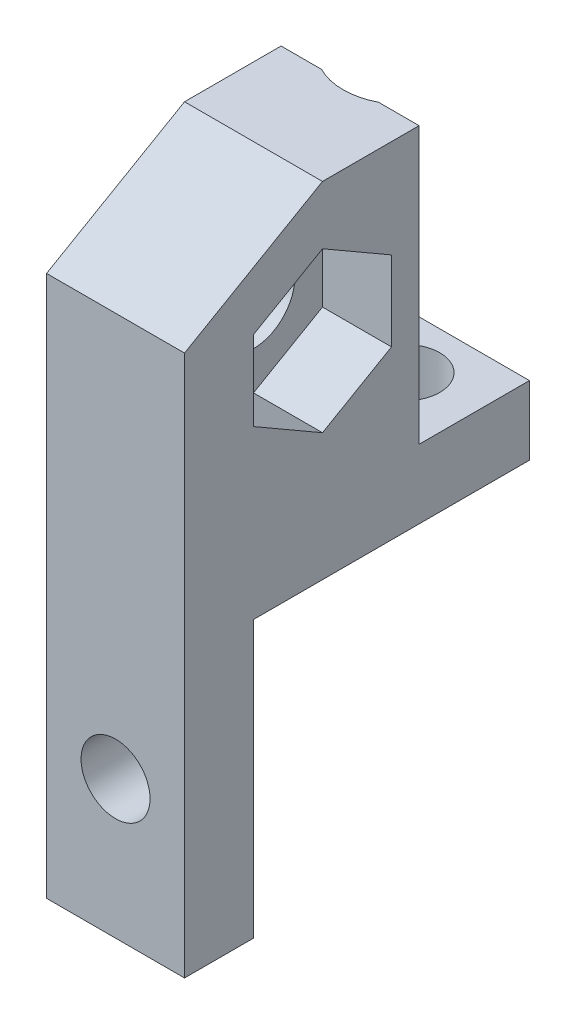
from build123d import *

# Parameters (mm, degrees)
SKETCH_1_R          = 3
EXTRUDE_1_DEPTH     = 5
EXTRUDE_START       = 5
EXTRUDE_2_DEPTH     = 5
SKETCH_3_R          = 2.5
CUT_EXTRUDE_1_DEPTH = 37.742346142
CHAMFER_1_SIZE      = 10
CHAMFER_1_SIZE2     = 5.773502692
SKETCH_4_W          = 8
SKETCH_4_H          = 20
CUT_EXTRUDE_2_DEPTH = 34.541019662
SKETCH_5_R          = 4.5
CUT_EXTRUDE_3_DEPTH = 34.541019662
CUT_EXTRUDE_4_DEPTH = 34.541019662


with BuildPart() as part:
    # 스케치1 → 보스-돌출1 (new body)
    # profile 1 of 2: a face of its own
    with BuildSketch(Plane(origin=(0, 0, 0), x_dir=(0, 0, -1), z_dir=(1, 0, 0))):
        Polygon((20, 0), (0, 0), (0, -20), (-5, -20), (-5, 25), (20, 25), align=None)
        Polygon((10, 17.886751346), (5, 20.773502692), (0, 17.886751346), (0, 12.113248654), (5, 9.226497308), (10, 12.113248654), align=None, mode=Mode.SUBTRACT)
    # profile 2 of 2: a face of its own
    with BuildSketch(Plane(origin=(0, 0, 0), x_dir=(0, 0, -1), z_dir=(1, 0, 0))):
        Polygon((10, 12.113248654), (10, 17.886751346), (5, 20.773502692), (0, 17.886751346), (0, 12.113248654), (5, 9.226497308), align=None)
        with Locations((5, 15)):
            Circle(SKETCH_1_R, mode=Mode.SUBTRACT)
    extrude(amount=EXTRUDE_1_DEPTH)

    # 스케치1<3> → 보스-돌출2 (add)
    with BuildSketch(Plane(origin=(0, 0, 0), x_dir=(0, 0, -1), z_dir=(1, 0, 0)).offset(EXTRUDE_START)):
        Polygon((20, 0), (0, 0), (0, -20), (-5, -20), (-5, 25), (20, 25), align=None)
        Polygon((10, 17.886751346), (5, 20.773502692), (0, 17.886751346), (0, 12.113248654), (5, 9.226497308), (10, 12.113248654), align=None, mode=Mode.SUBTRACT)
    extrude(amount=EXTRUDE_2_DEPTH)

    # 스케치3 → 컷-돌출1 (cut, through all)
    with BuildSketch(Plane.XY.offset(5)):
        with Locations((5, -10)):
            Circle(SKETCH_3_R)
    extrude(amount=-CUT_EXTRUDE_1_DEPTH, mode=Mode.SUBTRACT)

    # 모따기1
    chamfer_1_edges = [part.edges().sort_by_distance(p)[0] for p in [
        (5, 25, 5),
    ]]
    chamfer_1_side = [part.faces().sort_by_distance(p)[0] for p in [
        (5, 25, -7.5),
    ]]
    chamfer(chamfer_1_edges, length=CHAMFER_1_SIZE, length2=CHAMFER_1_SIZE2, reference=chamfer_1_side[0])

    # 스케치4 → 컷-돌출2 (cut, through all)
    with BuildSketch(Plane(origin=(10, 0, 0), x_dir=(0, 0, -1), z_dir=(1, 0, 0))):
        with Locations((16, 15)):
            Rectangle(SKETCH_4_W, SKETCH_4_H)
    extrude(amount=-CUT_EXTRUDE_2_DEPTH, mode=Mode.SUBTRACT)

    # 스케치5 → 컷-돌출3 (cut, through all)
    with BuildSketch(Plane(origin=(0, 5, 0), x_dir=(1, 0, 0), z_dir=(0, 1, 0))):
        with Locations((5, 16)):
            Circle(SKETCH_5_R)
    extrude(amount=CUT_EXTRUDE_3_DEPTH, mode=Mode.SUBTRACT)

    # 스케치5<3> → 컷-돌출4 (cut, through all)
    with BuildSketch(Plane(origin=(0, 5, 0), x_dir=(1, 0, 0), z_dir=(0, 1, 0))):
        with BuildLine():
            ThreePointArc((5, 18.5), (2.5, 16), (5, 13.5))
            Line((5, 13.5), (5, 18.5))
        make_face()
        with BuildLine():
            Line((5, 18.5), (5, 13.5))
            ThreePointArc((5, 13.5), (6.767766953, 14.232233047), (7.5, 16))
            ThreePointArc((7.5, 16), (6.767766953, 17.767766953), (5, 18.5))
        make_face()
    extrude(amount=-CUT_EXTRUDE_4_DEPTH, mode=Mode.SUBTRACT)


solid = part.part
